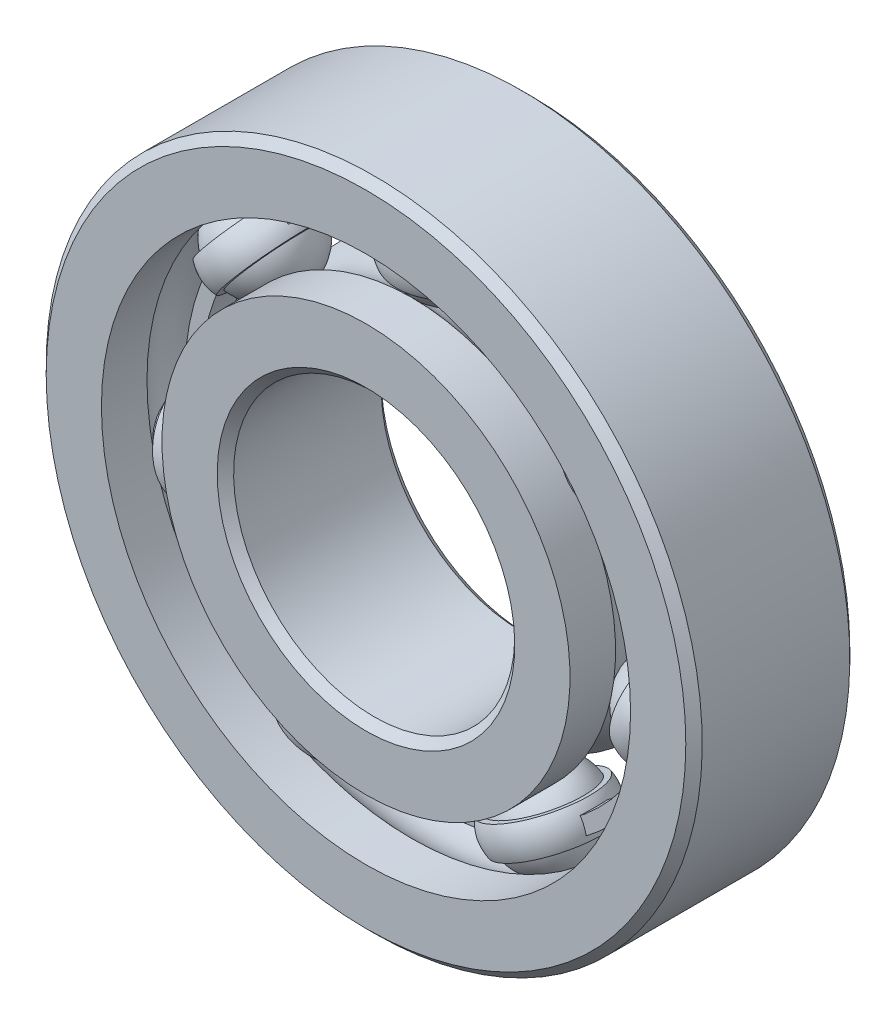
from build123d import *

# Parameters (mm, degrees)
CIRPATTERN1_COUNT   = 7
SKETCH9_R           = 8.450384615
SKETCH9_R_2         = 7.9375
BOSS_EXTRUDE1_DEPTH = 0.463020833


with BuildPart() as part:
    # Sketch7 → Revolve6 (revolve)
    with BuildSketch(Plane(origin=(0, 0, 0), x_dir=(0, 0, -1), z_dir=(1, 0, 0)), mode=Mode.PRIVATE) as revolve6_sk:
        with BuildLine():
            Line((2.5003125, 11.1125), (2.778125, 10.8346875))
            Line((2.778125, 10.8346875), (2.778125, 8.963269231))
            Line((2.778125, 8.963269231), (1.234722222, 8.963269231))
            ThreePointArc((1.234722222, 8.963269231), (0, 9.542723187), (-1.234722222, 8.963269231))
            Line((-1.234722222, 8.963269231), (-2.778125, 8.963269231))
            Line((-2.778125, 8.963269231), (-2.778125, 10.8346875))
            Line((-2.778125, 10.8346875), (-2.5003125, 11.1125))
            Line((-2.5003125, 11.1125), (2.5003125, 11.1125))
        make_face()
    revolve(revolve6_sk.sketch.rotate(Axis((0, 0, 2.778125), (0, 0, -1)), 180), axis=Axis((0, 0, 2.778125), (0, 0, -1)))


with BuildPart() as body_2:
    # Sketch3 → Revolve3 (revolve)
    with BuildSketch(Plane(origin=(0, 0, 0), x_dir=(0, 0, -1), z_dir=(1, 0, 0)), mode=Mode.PRIVATE) as revolve3_sk:
        with BuildLine():
            Line((-2.5003125, 4.7625), (-2.778125, 5.0403125))
            Line((-2.778125, 5.0403125), (-2.778125, 6.911730769))
            Line((-2.778125, 6.911730769), (-1.234722222, 6.911730769))
            ThreePointArc((-1.234722222, 6.911730769), (0, 6.332276813), (1.234722222, 6.911730769))
            Line((1.234722222, 6.911730769), (2.778125, 6.911730769))
            Line((2.778125, 6.911730769), (2.778125, 5.0403125))
            Line((2.778125, 5.0403125), (2.5003125, 4.7625))
            Line((2.5003125, 4.7625), (-2.5003125, 4.7625))
        make_face()
    revolve(revolve3_sk.sketch.rotate(Axis((0, 0, 2.778125), (0, 0, -1)), 180), axis=Axis((0, 0, 2.778125), (0, 0, -1)))


with BuildPart() as body_3:
    # Sketch4 → Revolve4 (revolve)
    with BuildSketch(Plane(origin=(0, 0, 0), x_dir=(0, 0, -1), z_dir=(1, 0, 0))):
        with BuildLine():
            Line((-1.605223187, 7.9375), (1.605223187, 7.9375))
            ThreePointArc((1.605223187, 7.9375), (0, 9.542723187), (-1.605223187, 7.9375))
        make_face()
    revolve(axis=Axis((0, 7.9375, 1.605223187), (0, 0, -1)))


with BuildPart() as body_4:
    # Sketch8 → Revolve7 (revolve)
    with BuildSketch(Plane(origin=(0, 0, 0), x_dir=(0, 0, -1), z_dir=(1, 0, 0))):
        with BuildLine():
            Line((-1.521082132, 8.450384615), (-1.730589277, 8.450384615))
            ThreePointArc((-1.730589277, 8.450384615), (-1.835342849, 7.9375), (-1.730589277, 7.424615385))
            Line((-1.730589277, 7.424615385), (-1.521082132, 7.424615385))
            ThreePointArc((-1.521082132, 7.424615385), (-1.605223187, 7.9375), (-1.521082132, 8.450384615))
        make_face()
    revolve(axis=Axis((0, 11.1125, 0), (0, -1, 0)))


with BuildPart() as cirpattern1_1:
    # CirPattern1: pattern copy
    add(body_4.part.rotate(Axis((0, 0, 0), (0, 0, 1)), 1 * 360 / CIRPATTERN1_COUNT))


with BuildPart() as cirpattern1_2:
    # CirPattern1: pattern copy
    add(body_4.part.rotate(Axis((0, 0, 0), (0, 0, 1)), 2 * 360 / CIRPATTERN1_COUNT))


with BuildPart() as cirpattern1_3:
    # CirPattern1: pattern copy
    add(body_4.part.rotate(Axis((0, 0, 0), (0, 0, 1)), 3 * 360 / CIRPATTERN1_COUNT))


with BuildPart() as cirpattern1_4:
    # CirPattern1: pattern copy
    add(body_4.part.rotate(Axis((0, 0, 0), (0, 0, 1)), 4 * 360 / CIRPATTERN1_COUNT))


with BuildPart() as cirpattern1_5:
    # CirPattern1: pattern copy
    add(body_4.part.rotate(Axis((0, 0, 0), (0, 0, 1)), 5 * 360 / CIRPATTERN1_COUNT))


with BuildPart() as cirpattern1_6:
    # CirPattern1: pattern copy
    add(body_4.part.rotate(Axis((0, 0, 0), (0, 0, 1)), 6 * 360 / CIRPATTERN1_COUNT))


with BuildPart() as cirpattern1_7:
    # CirPattern1: pattern copy
    add(body_3.part.rotate(Axis((0, 0, 0), (0, 0, 1)), 1 * 360 / CIRPATTERN1_COUNT))


with BuildPart() as cirpattern1_8:
    # CirPattern1: pattern copy
    add(body_3.part.rotate(Axis((0, 0, 0), (0, 0, 1)), 2 * 360 / CIRPATTERN1_COUNT))


with BuildPart() as cirpattern1_9:
    # CirPattern1: pattern copy
    add(body_3.part.rotate(Axis((0, 0, 0), (0, 0, 1)), 3 * 360 / CIRPATTERN1_COUNT))


with BuildPart() as cirpattern1_10:
    # CirPattern1: pattern copy
    add(body_3.part.rotate(Axis((0, 0, 0), (0, 0, 1)), 4 * 360 / CIRPATTERN1_COUNT))


with BuildPart() as cirpattern1_11:
    # CirPattern1: pattern copy
    add(body_3.part.rotate(Axis((0, 0, 0), (0, 0, 1)), 5 * 360 / CIRPATTERN1_COUNT))


with BuildPart() as cirpattern1_12:
    # CirPattern1: pattern copy
    add(body_3.part.rotate(Axis((0, 0, 0), (0, 0, 1)), 6 * 360 / CIRPATTERN1_COUNT))


with BuildPart() as body_17:
    # Sketch9 → Boss-Extrude1 (new, symmetric)
    with BuildSketch(Plane.XY):
        Circle(SKETCH9_R)
        Circle(SKETCH9_R_2, mode=Mode.SUBTRACT)
    extrude(amount=BOSS_EXTRUDE1_DEPTH, both=True)


solid = Compound([part.part, body_2.part, body_3.part, body_4.part, cirpattern1_1.part, cirpattern1_2.part, cirpattern1_3.part, cirpattern1_4.part, cirpattern1_5.part, cirpattern1_6.part, cirpattern1_7.part, cirpattern1_8.part, cirpattern1_9.part, cirpattern1_10.part, cirpattern1_11.part, cirpattern1_12.part, body_17.part])
